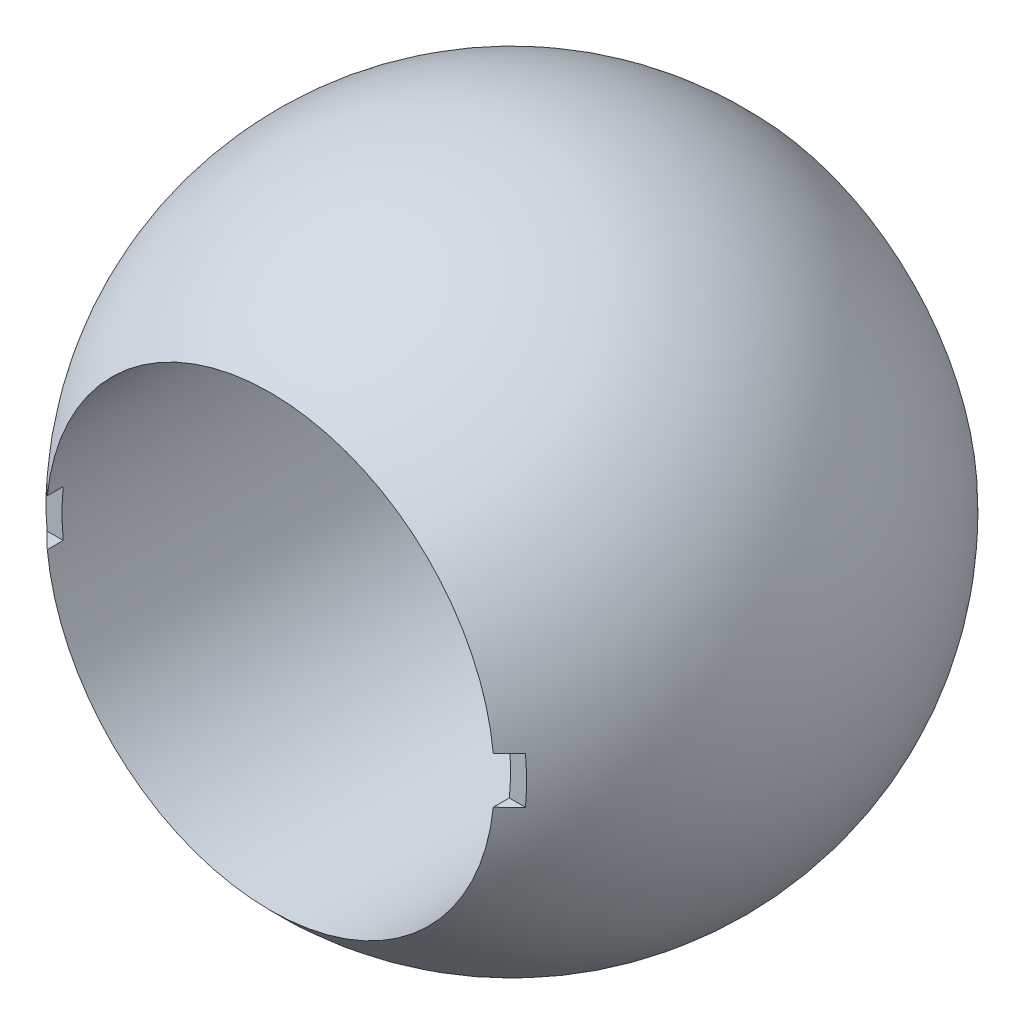
from build123d import *

# Parameters (mm, degrees)
CUT_EXTRUDE1_DEPTH      = 13.124355653
CUT_EXTRUDE1_DEPTH_BACK = 13.124355653
SKETCH2_R               = 4.7625
CUT_EXTRUDE2_DEPTH      = 12.14982483
CUT_EXTRUDE2_DEPTH_BACK = 12.14982483
SKETCH3_W               = 0.678207446
SKETCH3_H               = 0.99055699


with BuildPart() as part:
    # Sketch1 → Revolve1 (revolve)
    with BuildSketch(Plane(origin=(0, 0, 0), x_dir=(1, 0, 0), z_dir=(0, 1, 0))):
        with BuildLine():
            Line((0, 7), (0, -7))
            ThreePointArc((0, -7), (-7, 0), (0, 7))
        make_face()
    revolve(axis=Axis((0, 0, -7), (0, 0, 1)))

    # Sketch2 → Cut-Extrude1 (cut, two sides: drawn at the far end of the back side and taken through both)
    with BuildSketch(Plane.XY.offset(-CUT_EXTRUDE1_DEPTH_BACK)):
        Circle(SKETCH2_R)
    extrude(amount=CUT_EXTRUDE1_DEPTH + CUT_EXTRUDE1_DEPTH_BACK, mode=Mode.SUBTRACT)

    # Sketch3 → Cut-Extrude2 (cut, two sides: drawn at the far end of the back side and taken through both)
    with BuildSketch(Plane(origin=(0, 0, 0), x_dir=(0, 0, -1), z_dir=(1, 0, 0)).offset(-CUT_EXTRUDE2_DEPTH_BACK)):
        with Locations((-5.13016508, 0)):
            Rectangle(SKETCH3_W, SKETCH3_H)
    extrude(amount=CUT_EXTRUDE2_DEPTH + CUT_EXTRUDE2_DEPTH_BACK, mode=Mode.SUBTRACT)


solid = part.part
